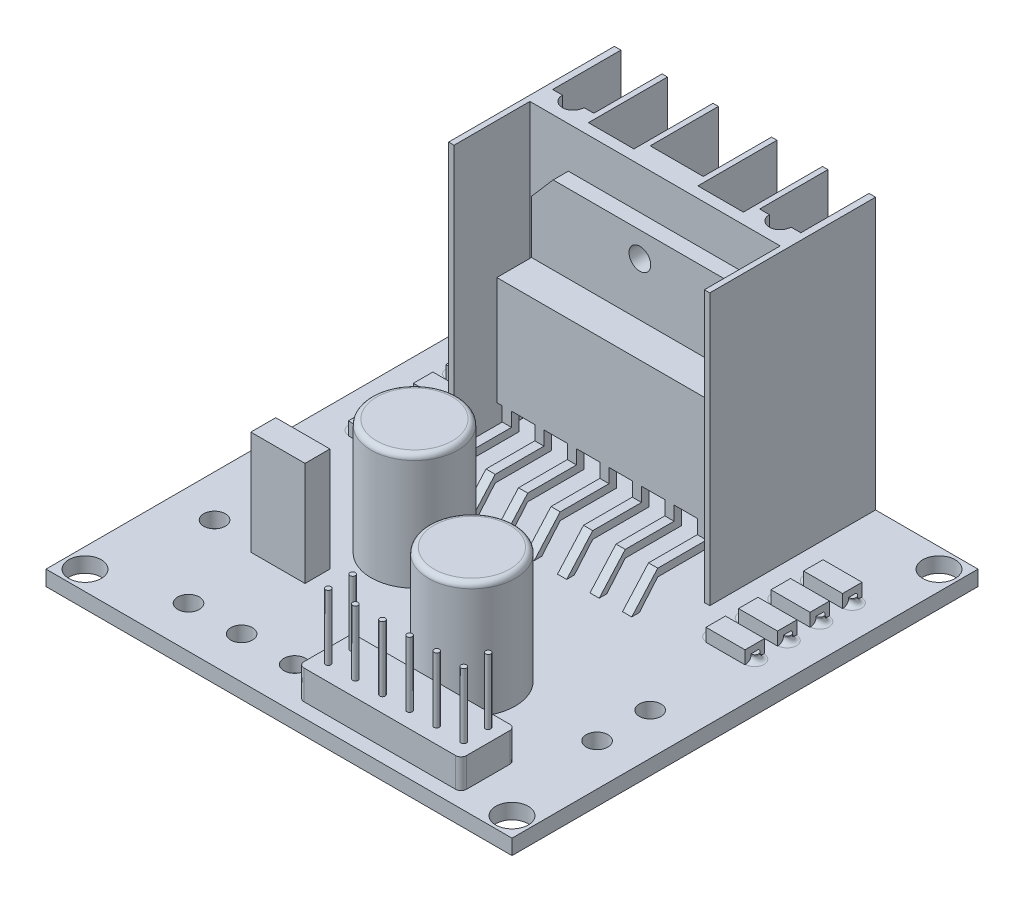
from build123d import *

# Parameters (mm, degrees)
CROQUIS1_W               = 43
CROQUIS1_H               = 43
CROQUIS1_R               = 1.5
SALIENTE_EXTRUIR1_DEPTH  = 1.4
CROQUIS2_R               = 4
SALIENTE_EXTRUIR2_DEPTH  = 10.7
REDONDEO1_R              = 0.5
CROQUIS3_R               = 1
CORTAR_EXTRUIR1_DEPTH    = 1.4
CROQUIS4_W               = 5
CROQUIS4_H               = 2.3
SALIENTE_EXTRUIR3_DEPTH  = 9.6
CROQUIS5_W               = 15
CROQUIS5_H               = 5
SALIENTE_EXTRUIR4_DEPTH  = 2.7
REDONDEO2_R              = 0.5
CROQUIS6_R               = 0.25
SALIENTE_EXTRUIR5_DEPTH  = 6
CROQUIS7_W               = 3.6
CROQUIS7_H               = 1.8
SALIENTE_EXTRUIR6_DEPTH  = 1.2
SALIENTE_EXTRUIR7_DEPTH  = 0.6
REDONDEO3_R              = 0.5
MATRIZL1_COUNT           = 4
MATRIZL1_PITCH           = 3
MATRIZL1_COUNT_DIR2      = 2
MATRIZL1_PITCH_DIR2      = 33
REDONDEO3_OF_MATRIZL1_R  = 0.5
SALIENTE_EXTRUIR8_DEPTH  = 25
CROQUIS9_W               = 20
CROQUIS9_H               = 10
SALIENTE_EXTRUIR9_DEPTH  = 4.6
CROQUIS9_3_R             = 1
SALIENTE_EXTRUIR10_DEPTH = 1.4
CORTAR_EXTRUIR2_START    = -2
CROQUIS9_4_R             = 1
CORTAR_EXTRUIR2_DEPTH    = 2
SALIENTE_EXTRUIR11_START = -0.5
SALIENTE_EXTRUIR11_DEPTH = 0.85
MATRIZL2_COUNT           = 4
MATRIZL2_PITCH           = 3
MATRIZL2_COL_COUNT       = 4
MATRIZL2_COL_PITCH       = 3


with BuildPart() as part:
    # Croquis1 → Saliente-Extruir1 (new body)
    with BuildSketch(Plane(origin=(0, 0, 0), x_dir=(1, 0, 0), z_dir=(0, 1, 0))):
        Rectangle(CROQUIS1_W, CROQUIS1_H)
        with Locations(Location((19.7, 19.7, 0), (0, 0, 270))):
            Circle(CROQUIS1_R, mode=Mode.SUBTRACT)
        with Locations(Location((-19.7, 19.7, 0), (0, 0, 270))):
            Circle(CROQUIS1_R, mode=Mode.SUBTRACT)
        with Locations(Location((-19.7, -19.7, 0), (0, 0, 270))):
            Circle(CROQUIS1_R, mode=Mode.SUBTRACT)
        with Locations(Location((19.7, -19.7, 0), (0, 0, 270))):
            Circle(CROQUIS1_R, mode=Mode.SUBTRACT)
    extrude(amount=SALIENTE_EXTRUIR1_DEPTH)

    # Croquis2 → Saliente-Extruir2 (add)
    with BuildSketch(Plane(origin=(0, 1.4, 0), x_dir=(1, 0, 0), z_dir=(0, 1, 0))):
        with Locations(Location((7.1, -10.8, 0), (0, 0, 270))):
            Circle(CROQUIS2_R)
        with Locations(Location((-5.8, -3.2, 0), (0, 0, 270))):
            Circle(CROQUIS2_R)
    extrude(amount=SALIENTE_EXTRUIR2_DEPTH)

    # Redondeo1
    redondeo1_edges = [part.edges().sort_by_distance(p)[0] for p in [
        (7.1, 12.1, 6.8),
        (-5.8, 12.1, -0.8),
    ]]
    fillet(redondeo1_edges, radius=REDONDEO1_R)

    # Croquis3 → Cortar-Extruir1 (cut)
    with BuildSketch(Plane(origin=(0, 1.4, 0), x_dir=(1, 0, 0), z_dir=(0, 1, 0))):
        with Locations(Location((-17.65, -4.9, 0), (0, 0, 270))):
            Circle(CROQUIS3_R)
        with Locations(Location((-17.65, -9.8, 0), (0, 0, 270))):
            Circle(CROQUIS3_R)
        with Locations(Location((-12.2, -17.65, 0), (0, 0, 270))):
            Circle(CROQUIS3_R)
        with Locations(Location((-7.3, -17.65, 0), (0, 0, 270))):
            Circle(CROQUIS3_R)
        with Locations(Location((-2.4, -17.65, 0), (0, 0, 270))):
            Circle(CROQUIS3_R)
        with Locations(Location((17.65, -4.9, 0), (0, 0, 270))):
            Circle(CROQUIS3_R)
        with Locations(Location((17.65, -9.8, 0), (0, 0, 270))):
            Circle(CROQUIS3_R)
    extrude(amount=-CORTAR_EXTRUIR1_DEPTH, mode=Mode.SUBTRACT)

    # Croquis4 → Saliente-Extruir3 (add)
    with BuildSketch(Plane(origin=(0, 1.4, 0), x_dir=(1, 0, 0), z_dir=(0, 1, 0))):
        with Locations((-10.9, -9.55)):
            Rectangle(CROQUIS4_W, CROQUIS4_H)
    extrude(amount=SALIENTE_EXTRUIR3_DEPTH)

    # Croquis5 → Saliente-Extruir4 (add)
    with BuildSketch(Plane(origin=(0, 1.4, 0), x_dir=(1, 0, 0), z_dir=(0, 1, 0))):
        with Locations((8, -17.7)):
            Rectangle(CROQUIS5_W, CROQUIS5_H)
    extrude(amount=SALIENTE_EXTRUIR4_DEPTH)

    # Redondeo2
    redondeo2_edges = [part.edges().sort_by_distance(p)[0] for p in [
        (15.5, 2.75, 15.2),
        (0.5, 2.75, 15.2),
        (0.5, 2.75, 20.2),
        (15.5, 2.75, 20.2),
    ]]
    fillet(redondeo2_edges, radius=REDONDEO2_R)

    # Croquis6 → Saliente-Extruir5 (add)
    with BuildSketch(Plane(origin=(0, 4.1, 0), x_dir=(1, 0, 0), z_dir=(0, 1, 0))):
        with Locations(Location((1.75, -16.45, 0), (0, 0, 270))):
            Circle(CROQUIS6_R)
        with Locations(Location((1.75, -18.7, 0), (0, 0, 270))):
            Circle(CROQUIS6_R)
        with Locations(Location((4.25, -18.7, 0), (0, 0, 270))):
            Circle(CROQUIS6_R)
        with Locations(Location((6.75, -18.7, 0), (0, 0, 270))):
            Circle(CROQUIS6_R)
        with Locations(Location((9.25, -18.7, 0), (0, 0, 270))):
            Circle(CROQUIS6_R)
        with Locations(Location((11.75, -18.7, 0), (0, 0, 270))):
            Circle(CROQUIS6_R)
        with Locations(Location((14.25, -18.7, 0), (0, 0, 270))):
            Circle(CROQUIS6_R)
        with Locations(Location((14.25, -16.45, 0), (0, 0, 270))):
            Circle(CROQUIS6_R)
    extrude(amount=SALIENTE_EXTRUIR5_DEPTH)

    # Croquis7 → Saliente-Extruir6 (add)
    with BuildSketch(Plane(origin=(0, 1.4, 0), x_dir=(1, 0, 0), z_dir=(0, 1, 0))):
        with Locations((-16.4, 13)):
            Rectangle(CROQUIS7_W, CROQUIS7_H)
    saliente_extruir6 = extrude(amount=SALIENTE_EXTRUIR6_DEPTH)

    # Croquis7<3> → Saliente-Extruir7 (add)
    with BuildSketch(Plane(origin=(0, 1.4, 0), x_dir=(1, 0, 0), z_dir=(0, 1, 0))):
        with BuildLine():
            ThreePointArc((-17.85, 13), (-17.952512627, 13.247487373), (-18.2, 13.35))
            Line((-18.2, 13.35), (-18.2, 12.65))
            ThreePointArc((-18.2, 12.65), (-17.952512627, 12.752512627), (-17.85, 13))
        make_face()
        with BuildLine():
            Line((-18.2, 12.65), (-18.2, 13.35))
            ThreePointArc((-18.2, 13.35), (-18.55, 13), (-18.2, 12.65))
        make_face()
        with BuildLine():
            ThreePointArc((-14.25, 13), (-14.352512627, 13.247487373), (-14.6, 13.35))
            Line((-14.6, 13.35), (-14.6, 12.65))
            ThreePointArc((-14.6, 12.65), (-14.352512627, 12.752512627), (-14.25, 13))
        make_face()
        with BuildLine():
            Line((-14.6, 12.65), (-14.6, 13.35))
            ThreePointArc((-14.6, 13.35), (-14.95, 13), (-14.6, 12.65))
        make_face()
    saliente_extruir7 = extrude(amount=SALIENTE_EXTRUIR7_DEPTH)

    # Redondeo3
    redondeo3_edges = [part.edges().sort_by_distance(p)[0] for p in [
        (-18.55, 1.4, -13),
        (-14.25, 1.4, -13),
    ]]
    fillet(redondeo3_edges, radius=REDONDEO3_R)

    # MatrizL1: Saliente-Extruir6, Saliente-Extruir7 4 × 2
    with Locations(*[(j * MATRIZL1_PITCH_DIR2, 0, i * MATRIZL1_PITCH) for i in range(MATRIZL1_COUNT) for j in range(MATRIZL1_COUNT_DIR2) if (i, j) != (0, 0)]):
        add(saliente_extruir6)
        add(saliente_extruir7)

    # Redondeo3 of MatrizL1
    redondeo3_of_matrizl1_edges = [part.edges().sort_by_distance(p)[0] for p in [
        (14.45, 1.4, -13),
        (18.75, 1.4, -13),
        (-18.55, 1.4, -10),
        (-14.25, 1.4, -10),
        (14.45, 1.4, -10),
        (18.75, 1.4, -10),
        (-18.55, 1.4, -7),
        (-14.25, 1.4, -7),
        (14.45, 1.4, -7),
        (18.75, 1.4, -7),
        (-18.55, 1.4, -4),
        (-14.25, 1.4, -4),
        (14.45, 1.4, -4),
        (18.75, 1.4, -4),
    ]]
    fillet(redondeo3_of_matrizl1_edges, radius=REDONDEO3_OF_MATRIZL1_R)

    # Croquis8 → Saliente-Extruir8 (add)
    with BuildSketch(Plane(origin=(0, 1.4, 0), x_dir=(1, 0, 0), z_dir=(0, 1, 0))):
        with BuildLine():
            Line((-12.05, 21.5), (-12.05, 6.2))
            Line((-12.05, 6.2), (-11.55, 6.2))
            Line((-11.55, 6.2), (-11.55, 13.2))
            Line((-11.55, 13.2), (11.55, 13.2))
            Line((11.55, 13.2), (11.55, 6.2))
            Line((11.55, 6.2), (12.05, 6.2))
            Line((12.05, 6.2), (12.05, 21.5))
            Line((12.05, 21.5), (11.45, 21.5))
            Line((11.45, 21.5), (11.45, 15.2))
            Line((11.45, 15.2), (10.55, 15.2))
            ThreePointArc((10.55, 15.2), (9.55, 14.2), (8.55, 15.2))
            Line((8.55, 15.2), (7.65, 15.2))
            Line((7.65, 15.2), (7.65, 21.5))
            Line((7.65, 21.5), (7.15, 21.5))
            Line((7.15, 21.5), (7.15, 14.2))
            Line((7.15, 14.2), (2.95, 14.2))
            Line((2.95, 14.2), (2.95, 21.5))
            Line((2.95, 21.5), (2.45, 21.5))
            Line((2.45, 21.5), (2.45, 15.2))
            Line((2.45, 15.2), (-2.45, 15.2))
            Line((-2.45, 15.2), (-2.45, 21.5))
            Line((-2.45, 21.5), (-2.95, 21.5))
            Line((-2.95, 21.5), (-2.95, 14.2))
            Line((-2.95, 14.2), (-7.15, 14.2))
            Line((-7.15, 14.2), (-7.15, 21.5))
            Line((-7.15, 21.5), (-7.65, 21.5))
            Line((-7.65, 21.5), (-7.65, 15.2))
            Line((-7.65, 15.2), (-8.55, 15.2))
            ThreePointArc((-8.55, 15.2), (-9.55, 14.2), (-10.55, 15.2))
            Line((-10.55, 15.2), (-11.45, 15.2))
            Line((-11.45, 15.2), (-11.45, 21.5))
            Line((-11.45, 21.5), (-12.05, 21.5))
        make_face()
    extrude(amount=SALIENTE_EXTRUIR8_DEPTH)

    # Croquis9 → Saliente-Extruir9 (add)
    with BuildSketch(Plane.XY.offset(-13.2)):
        with Locations((0, 10.4)):
            Rectangle(CROQUIS9_W, CROQUIS9_H)
    extrude(amount=SALIENTE_EXTRUIR9_DEPTH)

    # Croquis9<3> → Saliente-Extruir10 (add)
    with BuildSketch(Plane.XY.offset(-13.2)):
        Polygon((-8, 22.6), (-10, 20.3), (-10, 15.4), (10, 15.4), (10, 20.3), (8, 22.6), align=None)
        with Locations((0, 20.3)):
            Circle(CROQUIS9_3_R, mode=Mode.SUBTRACT)
    extrude(amount=SALIENTE_EXTRUIR10_DEPTH)

    # Croquis9<4> → Cortar-Extruir2 (cut)
    with BuildSketch(Plane.XY.offset(-13.2).offset(CORTAR_EXTRUIR2_START)):
        with Locations((0, 20.3)):
            Circle(CROQUIS9_4_R)
    extrude(amount=CORTAR_EXTRUIR2_DEPTH, mode=Mode.SUBTRACT)

    # Croquis10 → Saliente-Extruir11 (add)
    with BuildSketch(Plane(origin=(0, 0, 0), x_dir=(0, 0, -1), z_dir=(1, 0, 0)).offset(SALIENTE_EXTRUIR11_START)):
        Polygon((1.69842263, 1.4), (2.39842263, 1.4), (4.1, 3.4), (9.3, 3.4), (9.3, 5.4), (8.6, 5.4), (8.6, 4.1), (4.1, 4.1), align=None)
    saliente_extruir11 = extrude(amount=SALIENTE_EXTRUIR11_DEPTH)

    # MatrizL2: Saliente-Extruir11 ×4
    with Locations(*[(i * MATRIZL2_PITCH, 0, 0) for i in range(1, MATRIZL2_COUNT)]):
        add(saliente_extruir11)

    # MatrizL2 col: Saliente-Extruir11 ×4
    with Locations(*[(-i * MATRIZL2_COL_PITCH, 0, 0) for i in range(1, MATRIZL2_COL_COUNT)]):
        add(saliente_extruir11)


solid = part.part
